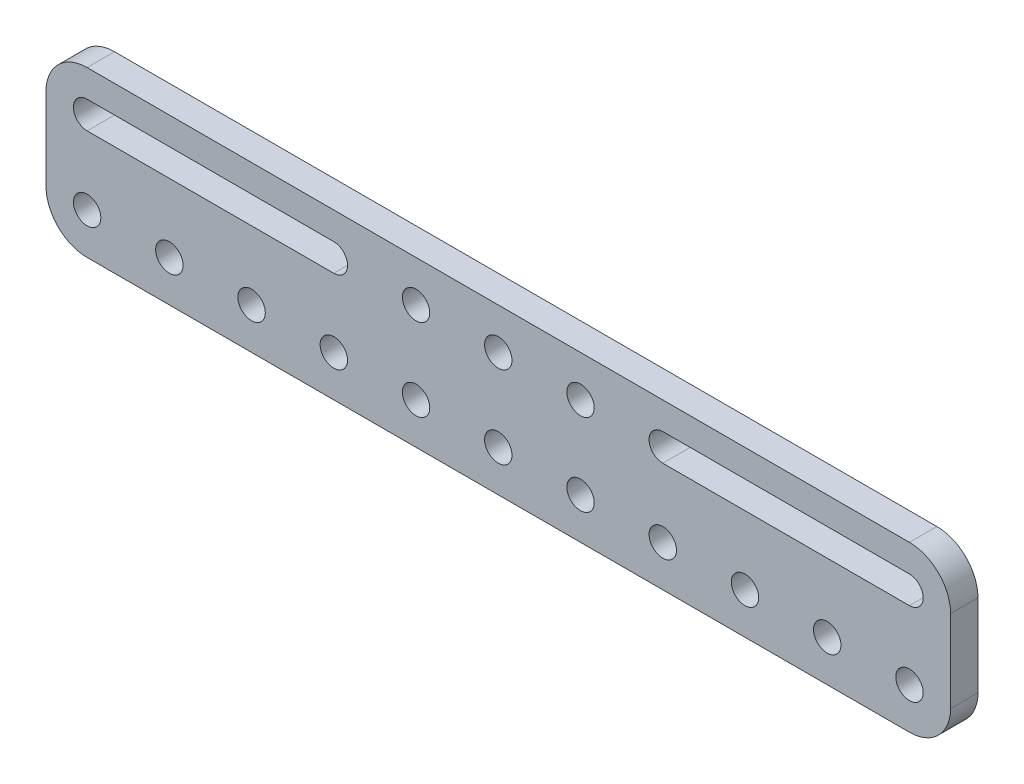
from build123d import *

# Parameters (mm, degrees)
MODEL_R                 = 1.5
SALIENTE_EXTRUIR1_DEPTH = 3


with BuildPart() as part:
    # Model → Saliente-Extruir1 (new body)
    with BuildSketch(Plane.XY):
        with BuildLine():
            Line((256.429131311, 228.742243614), (346.429131311, 228.742243614))
            ThreePointArc((346.429131311, 228.742243614), (349.611111826, 227.424224129), (350.929131311, 224.242243614))
            Line((350.929131311, 224.242243614), (350.929131311, 215.242243614))
            ThreePointArc((350.929131311, 215.242243614), (349.611111826, 212.060263099), (346.429131311, 210.742243614))
            Line((346.429131311, 210.742243614), (256.429131311, 210.742243614))
            ThreePointArc((256.429131311, 210.742243614), (253.247150795, 212.060263099), (251.929131311, 215.242243614))
            Line((251.929131311, 215.242243614), (251.929131311, 224.242243614))
            ThreePointArc((251.929131311, 224.242243614), (253.247150795, 227.424224129), (256.429131311, 228.742243614))
        make_face()
        with Locations((310.429131311, 224.242243614)):
            Circle(MODEL_R, mode=Mode.SUBTRACT)
        with Locations((292.429131311, 224.242243614)):
            Circle(MODEL_R, mode=Mode.SUBTRACT)
        with Locations((301.429131311, 224.242243614)):
            Circle(MODEL_R, mode=Mode.SUBTRACT)
        with Locations((337.429131311, 215.242243614)):
            Circle(MODEL_R, mode=Mode.SUBTRACT)
        with Locations((319.429131311, 215.242243614)):
            Circle(MODEL_R, mode=Mode.SUBTRACT)
        with Locations((328.429131311, 215.242243614)):
            Circle(MODEL_R, mode=Mode.SUBTRACT)
        with Locations((310.429131311, 215.242243614)):
            Circle(MODEL_R, mode=Mode.SUBTRACT)
        with Locations((292.429131311, 215.242243614)):
            Circle(MODEL_R, mode=Mode.SUBTRACT)
        with Locations((301.429131311, 215.242243614)):
            Circle(MODEL_R, mode=Mode.SUBTRACT)
        with Locations((274.429131311, 215.242243614)):
            Circle(MODEL_R, mode=Mode.SUBTRACT)
        with Locations((283.429131311, 215.242243614)):
            Circle(MODEL_R, mode=Mode.SUBTRACT)
        with Locations((265.429131311, 215.242243614)):
            Circle(MODEL_R, mode=Mode.SUBTRACT)
        with Locations((256.429131311, 215.242243614)):
            Circle(MODEL_R, mode=Mode.SUBTRACT)
        with Locations((346.429131311, 215.242243614)):
            Circle(MODEL_R, mode=Mode.SUBTRACT)
        with BuildLine():
            Line((256.429131311, 225.742243614), (283.429131311, 225.742243614))
            ThreePointArc((283.429131311, 225.742243614), (284.929131311, 224.242243614), (283.429131311, 222.742243614))
            Line((283.429131311, 222.742243614), (256.429131311, 222.742243614))
            ThreePointArc((256.429131311, 222.742243614), (254.929131311, 224.242243614), (256.429131311, 225.742243614))
        make_face(mode=Mode.SUBTRACT)
        with BuildLine():
            Line((319.429131311, 225.742243614), (346.429131311, 225.742243614))
            ThreePointArc((346.429131311, 225.742243614), (347.929131311, 224.242243614), (346.429131311, 222.742243614))
            Line((346.429131311, 222.742243614), (319.429131311, 222.742243614))
            ThreePointArc((319.429131311, 222.742243614), (317.929131311, 224.242243614), (319.429131311, 225.742243614))
        make_face(mode=Mode.SUBTRACT)
    extrude(amount=SALIENTE_EXTRUIR1_DEPTH)


solid = part.part
